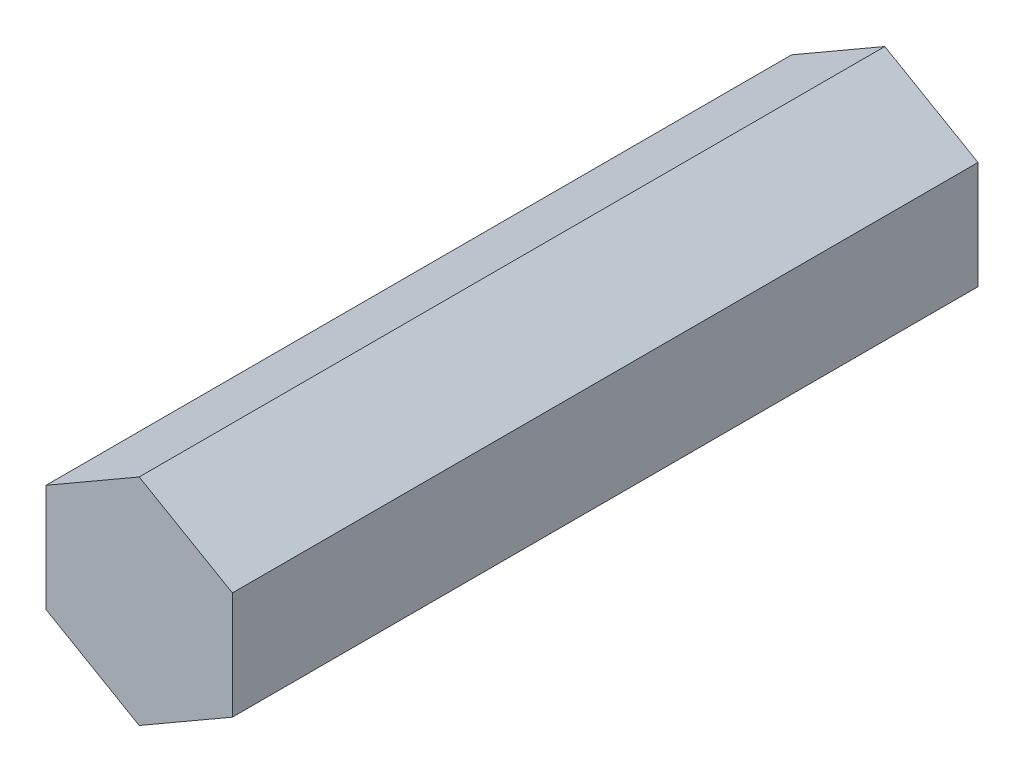
from build123d import *

# Parameters (mm, degrees)
RESSALTO_EXTRUS_O1_DEPTH = 120
CORTE_EXTRUS_O1_DEPTH    = 40


with BuildPart() as part:
    # Esboço2 → Ressalto-extrusão1 (new body)
    with BuildSketch(Plane.XY):
        Polygon((15, 8.660254038), (0, 17.320508076), (-15, 8.660254038), (-15, -8.660254038), (0, -17.320508076), (15, -8.660254038), align=None)
    extrude(amount=RESSALTO_EXTRUS_O1_DEPTH)

    # Esboço1 → Corte-extrusão1 (cut)
    with BuildSketch(Plane.XY):
        Polygon((9, 5.196152423), (0, 10.392304845), (-9, 5.196152423), (-9, -5.196152423), (0, -10.392304845), (9, -5.196152423), align=None)
    extrude(amount=CORTE_EXTRUS_O1_DEPTH, mode=Mode.SUBTRACT)


solid = part.part
